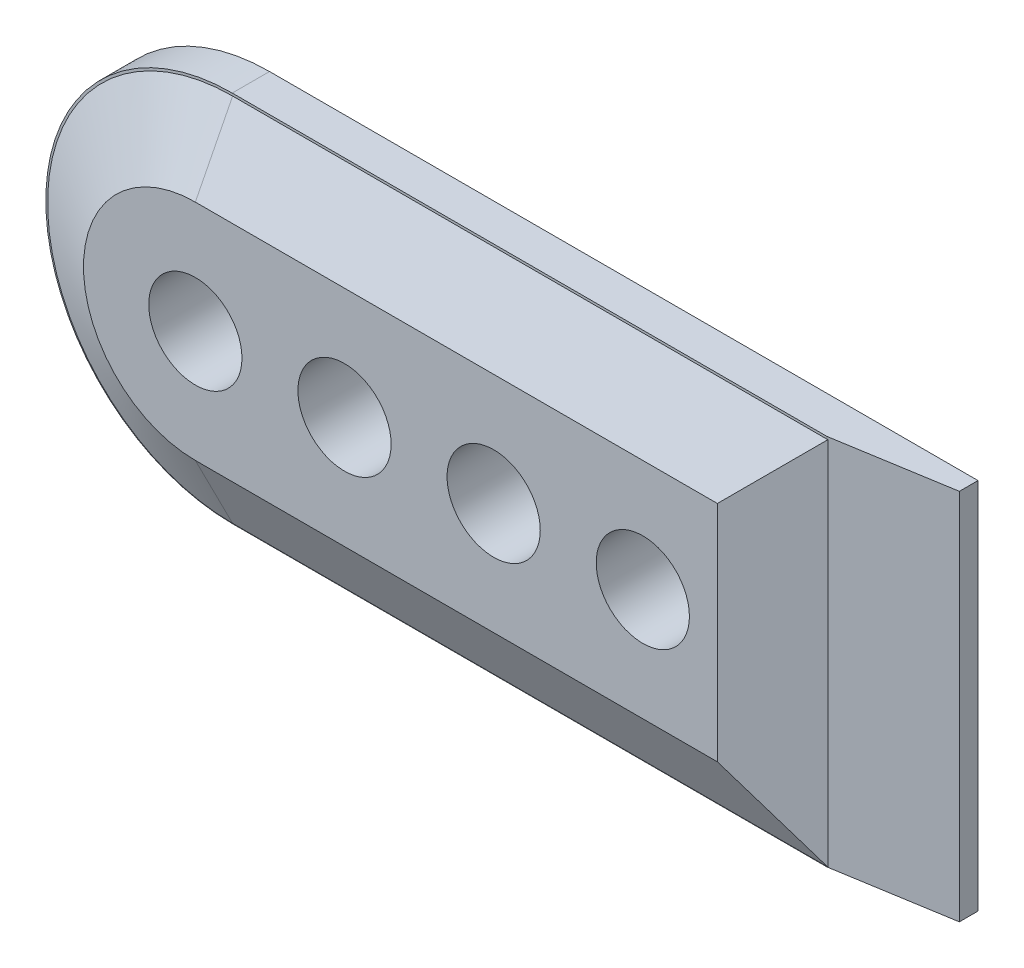
from build123d import *

# Parameters (mm, degrees)
BOSS_EXTRUDE1_DEPTH = 6.35
BOSS_EXTRUDE2_DEPTH = 6.35
BOSS_EXTRUDE2_DRAFT = 63
CUT_EXTRUDE1_DEPTH  = 63.5
SKETCH4_R           = 7.9375
CUT_EXTRUDE2_DEPTH  = 254


with BuildPart() as part:
    # Sketch1 → Boss-Extrude1 (new body)
    with BuildSketch(Plane.XY):
        with BuildLine():
            Line((-68.693731343, 19.059477612), (51.956268657, 19.059477612))
            Line((51.956268657, 19.059477612), (51.956268657, -44.440522388))
            Line((51.956268657, -44.440522388), (-68.693731343, -44.440522388))
            ThreePointArc((-68.693731343, -44.440522388), (-100.443731343, -12.690522388), (-68.693731343, 19.059477612))
        make_face()
    extrude(amount=BOSS_EXTRUDE1_DEPTH)


with BuildPart() as boss_extrude2_tool:
    # 3DSketch1 → Boss-Extrude2 (with draft: the straight prism first)
    with BuildSketch(Plane(origin=(-68.627300229, -31.913895704, 12.7), x_dir=(0.9191450300180579, 0.39391929857916763, 0), z_dir=(0, 0, 1))):
        with BuildLine():
            Line((0, 0), (81.711993169, -35.019425644))
            Line((81.711993169, -35.019425644), (96.720318444, 0))
            Line((96.720318444, 0), (15.008325276, 35.019425644))
            ThreePointArc((15.008325276, 35.019425644), (-10.005550184, 25.01387546), (0, 0))
        make_face()
    extrude(amount=-BOSS_EXTRUDE2_DEPTH)
    # Boss-Extrude2: the draft: its side faces are tilted about the plane it starts from
    boss_extrude2_sides = [boss_extrude2_tool.faces().sort_by_distance(p)[0] for p in [
        (-87.677300229, -12.863895704, 9.525),
        (-24.177300229, -31.913895704, 9.525),
        (20.272699771, -12.863895704, 9.525),
        (-24.177300229, 6.186104296, 9.525),
    ]]
    draft(boss_extrude2_sides, Plane(origin=(-68.627300229, -31.913895704, 12.7), x_dir=(0.9191450300180579, 0.39391929857916763, 0), z_dir=(0, 0, 1)), BOSS_EXTRUDE2_DRAFT)


with BuildPart() as part_1:
    add(part.part)

    # Boss-Extrude2: add boss_extrude2_tool
    add(boss_extrude2_tool.part)

    # Sketch3 → Cut-Extrude1 (cut)
    with BuildSketch(Plane.XZ.offset(44.440522388)):
        Polygon((32.598411505, 6.35), (51.956268657, 3.175), (51.956268657, 6.35), align=None)
    extrude(amount=-CUT_EXTRUDE1_DEPTH, mode=Mode.SUBTRACT)

    # Sketch4 → Cut-Extrude2 (cut)
    with BuildSketch(Plane.XY.offset(12.7)):
        with Locations((-68.627300229, -12.863895704)):
            Circle(SKETCH4_R)
        with Locations((-43.227300229, -12.863895704)):
            Circle(SKETCH4_R)
        with Locations((-17.827300229, -12.863895704)):
            Circle(SKETCH4_R)
        with Locations((7.572699771, -12.863895704)):
            Circle(SKETCH4_R)
    extrude(amount=-CUT_EXTRUDE2_DEPTH, mode=Mode.SUBTRACT)


solid = part_1.part
